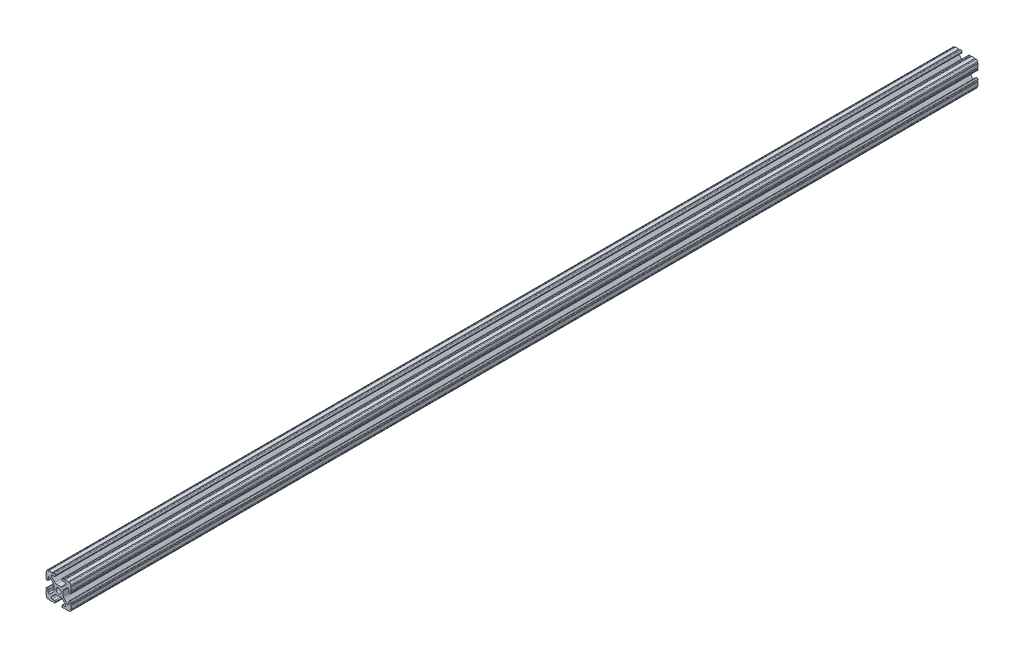
from build123d import *

# Parameters (mm, degrees)
BOSS_EXTRUDE1_DEPTH     = 457.2
CUT_EXTRUDE1_DEPTH      = 458.55264178
CUT_EXTRUDE1_DEPTH_BACK = 458.55264178
SKETCH5_R               = 0.55245


with BuildPart() as part:
    # Sketch4 → Boss-Extrude1 (new, symmetric)
    with BuildSketch(Plane.XY):
        with BuildLine():
            Line((4.190365, -12.7), (10.11729625, -12.7))
            ThreePointArc((10.11729625, -12.7), (11.943543585, -11.943543585), (12.7, -10.11729625))
            Line((12.7, -10.11729625), (12.7, -4.190365))
            ThreePointArc((12.7, -4.190365), (12.42492494, -3.52627506), (11.760835, -3.2512))
            Line((11.760835, -3.2512), (11.429365, -3.2512))
            ThreePointArc((11.429365, -3.2512), (10.76527506, -3.52627506), (10.4902, -4.190365))
            Line((10.4902, -4.190365), (10.4902, -6.348478019))
            ThreePointArc((10.4902, -6.348478019), (9.830707141, -7.335478831), (8.666460301, -7.103895736))
            Line((8.666460301, -7.103895736), (5.299899128, -3.737334563))
            ThreePointArc((5.299899128, -3.737334563), (4.817571085, -3.015479634), (4.6482, -2.16399369))
            Line((4.6482, -2.16399369), (4.6482, 0))
            Line((4.6482, 0), (2.6035, 0))
            ThreePointArc((2.6035, 0), (1.840952505, -1.840952505), (0, -2.6035))
            Line((0, -2.6035), (0, -4.6482))
            Line((0, -4.6482), (2.16399369, -4.6482))
            ThreePointArc((2.16399369, -4.6482), (3.015479634, -4.817571085), (3.737334563, -5.299899128))
            Line((3.737334563, -5.299899128), (7.103895736, -8.666460301))
            ThreePointArc((7.103895736, -8.666460301), (7.335478831, -9.830707141), (6.348478019, -10.4902))
            Line((6.348478019, -10.4902), (4.190365, -10.4902))
            ThreePointArc((4.190365, -10.4902), (3.52627506, -10.76527506), (3.2512, -11.429365))
            Line((3.2512, -11.429365), (3.2512, -11.760835))
            ThreePointArc((3.2512, -11.760835), (3.52627506, -12.42492494), (4.190365, -12.7))
        make_face()
    extrude(amount=BOSS_EXTRUDE1_DEPTH, both=True)

    # Sketch5 → Cut-Extrude1 (cut, two sides: drawn at the far end of the back side and taken through both)
    with BuildSketch(Plane.XY.offset(-CUT_EXTRUDE1_DEPTH_BACK)):
        with Locations((10.356153152, -12.7)):
            Circle(SKETCH5_R)
        with Locations((5.796028019, -12.7)):
            Circle(SKETCH5_R)
        with Locations((12.7, -10.356153152)):
            Circle(SKETCH5_R)
        with Locations((12.7, -5.796028019)):
            Circle(SKETCH5_R)
    extrude(amount=CUT_EXTRUDE1_DEPTH + CUT_EXTRUDE1_DEPTH_BACK, mode=Mode.SUBTRACT)

    # Mirror1: part across plane


with BuildPart() as part_1:
    add(part.part)
    add(part.part.mirror(Plane(origin=(0, 0, 0), x_dir=(0, 0, 1), z_dir=(1, 0, 0))))

    # Mirror2: part across plane


with BuildPart() as part_2:
    add(part_1.part)
    add(part_1.part.mirror(Plane.ZX))


solid = part_2.part
